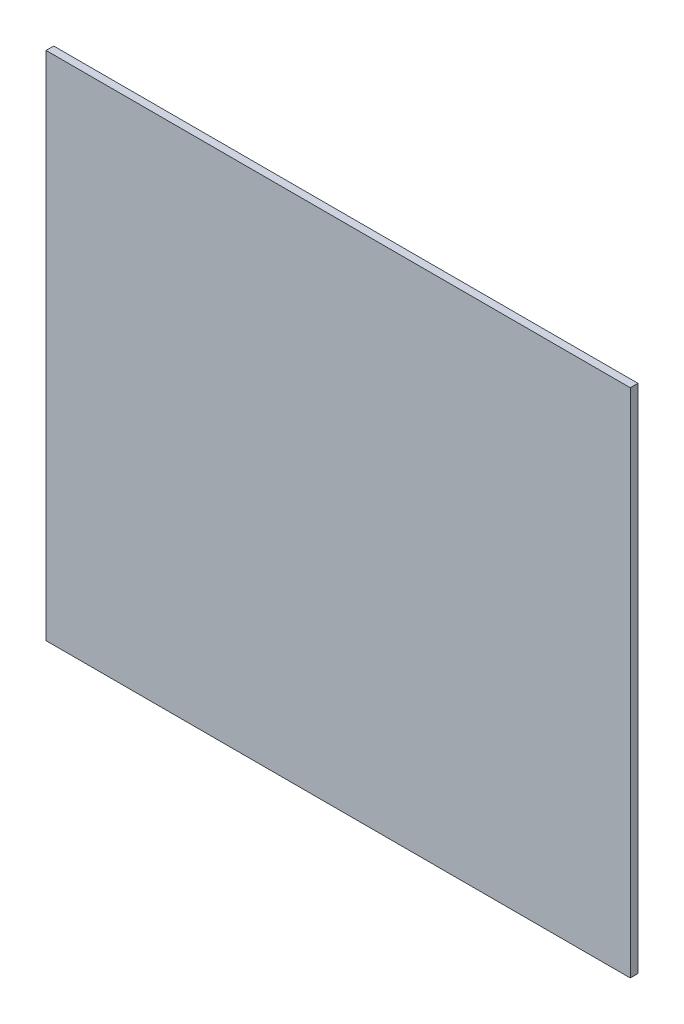
from build123d import *

# Parameters (mm, degrees)
SKETCH1_W           = 203.2
SKETCH1_H           = 177.8
BOSS_EXTRUDE1_DEPTH = 2.667


with BuildPart() as part:
    # Sketch1 → Boss-Extrude1 (new body)
    with BuildSketch(Plane.XY):
        Rectangle(SKETCH1_W, SKETCH1_H)
    extrude(amount=BOSS_EXTRUDE1_DEPTH)


solid = part.part
